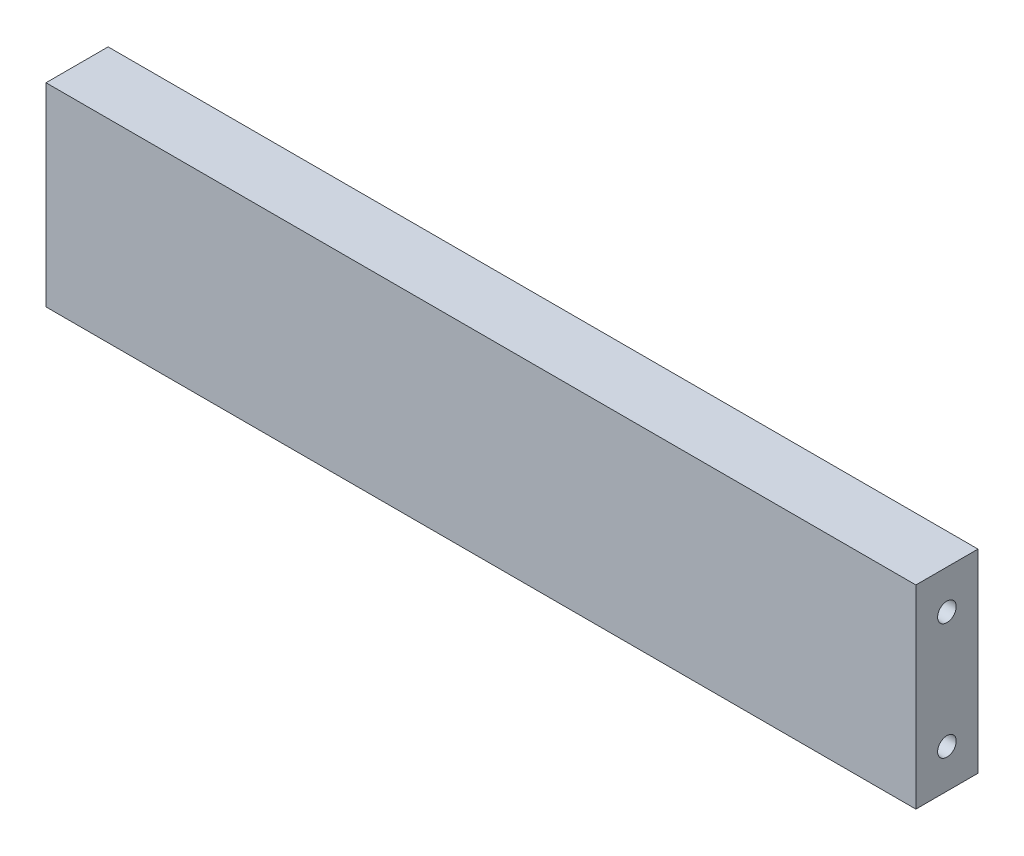
from build123d import *

# Parameters (mm, degrees)
ESQUISSE1_W             = 112
ESQUISSE1_H             = 25
BASE_EXTRUSION_DEPTH    = 8
ESQUISSE2_R             = 1.2
ENL_V_MAT_EXTRU_1_DEPTH = 11
ENL_V_START             = -11
ESQUISSE3_R             = 1.2
ENL_V_MAT_EXTRU_2_DEPTH = 11


with BuildPart() as part:
    # Esquisse1 → Base-Extrusion (new body)
    with BuildSketch(Plane.XY):
        with Locations((56, 12.5)):
            Rectangle(ESQUISSE1_W, ESQUISSE1_H)
    extrude(amount=BASE_EXTRUSION_DEPTH)

    # Esquisse2 → Enlèv. mat.-Extru.1 (cut)
    with BuildSketch(Plane(origin=(112, 0, 0), x_dir=(0, 0, -1), z_dir=(1, 0, 0))):
        with Locations((-4, 20)):
            Circle(ESQUISSE2_R)
        with Locations((-4, 5)):
            Circle(ESQUISSE2_R)
    extrude(amount=-ENL_V_MAT_EXTRU_1_DEPTH, mode=Mode.SUBTRACT)

    # Esquisse3 → Enlèv. mat.-Extru.2 (cut)
    with BuildSketch(Plane.ZY.offset(ENL_V_START)):
        with Locations(Location((4, 20, 0), (0, 0, 180))):
            Circle(ESQUISSE3_R)
        with Locations(Location((4, 5, 0), (0, 0, 180))):
            Circle(ESQUISSE3_R)
    extrude(amount=ENL_V_MAT_EXTRU_2_DEPTH, mode=Mode.SUBTRACT)


solid = part.part
